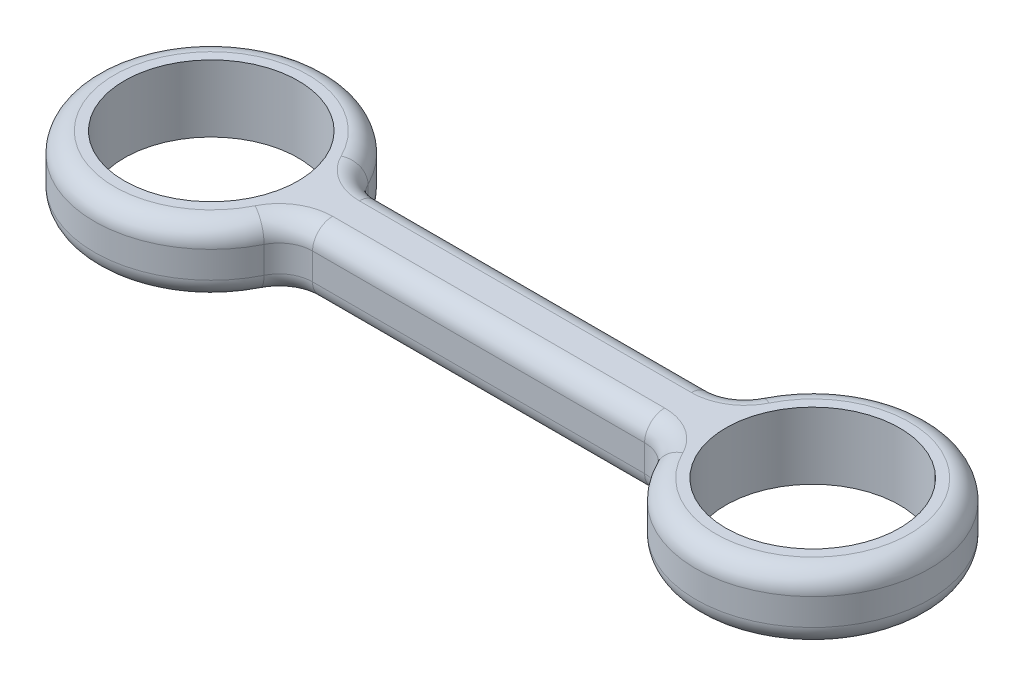
from build123d import *

# Parameters (mm, degrees)
SKETCH1_R           = 13
BOSS_EXTRUDE1_DEPTH = 5
FILLET1_R           = 5
FILLET2_R           = 3


with BuildPart() as part:
    # Sketch1 → Boss-Extrude1 (new, symmetric)
    with BuildSketch(Plane(origin=(0, 0, 0), x_dir=(1, 0, 0), z_dir=(0, 1, 0))):
        with BuildLine():
            Line((16.770509831, 5), (73.229490169, 5))
            ThreePointArc((73.229490169, 5), (107.5, 0), (73.229490169, -5))
            Line((73.229490169, -5), (16.770509831, -5))
            ThreePointArc((16.770509831, -5), (-17.5, 0), (16.770509831, 5))
        make_face()
        with Locations(Location((0, 0, 0), (0, 0, 270))):
            Circle(SKETCH1_R, mode=Mode.SUBTRACT)
        with Locations(Location((90, 0, 0), (0, 0, 270))):
            Circle(SKETCH1_R, mode=Mode.SUBTRACT)
    extrude(amount=BOSS_EXTRUDE1_DEPTH, both=True)

    # Fillet1
    fillet1_edges = [part.edges().sort_by_distance(p)[0] for p in [
        (16.770509831, 0, -5),
        (73.229490169, 0, -5),
        (73.229490169, 0, 5),
        (16.770509831, 0, 5),
    ]]
    fillet(fillet1_edges, radius=FILLET1_R)

    # Fillet2
    fillet2_edges = [part.edges().sort_by_distance(p)[0] for p in [
        (107.5, -5, 0),
        (107.5, 5, 0),
        (45, -5, 5),
        (45, 5, 5),
        (45, -5, -5),
        (45, 5, -5),
        (-17.5, -5, 0),
        (-17.5, 5, 0),
        (72.479587013, -5, 5.750817072),
        (72.479587013, 5, 5.750817072),
        (72.479587013, -5, -5.750817072),
        (72.479587013, 5, -5.750817072),
        (17.520412987, -5, -5.750817072),
        (17.520412987, 5, -5.750817072),
        (17.520412987, -5, 5.750817072),
        (17.520412987, 5, 5.750817072),
    ]]
    fillet(fillet2_edges, radius=FILLET2_R)


solid = part.part
